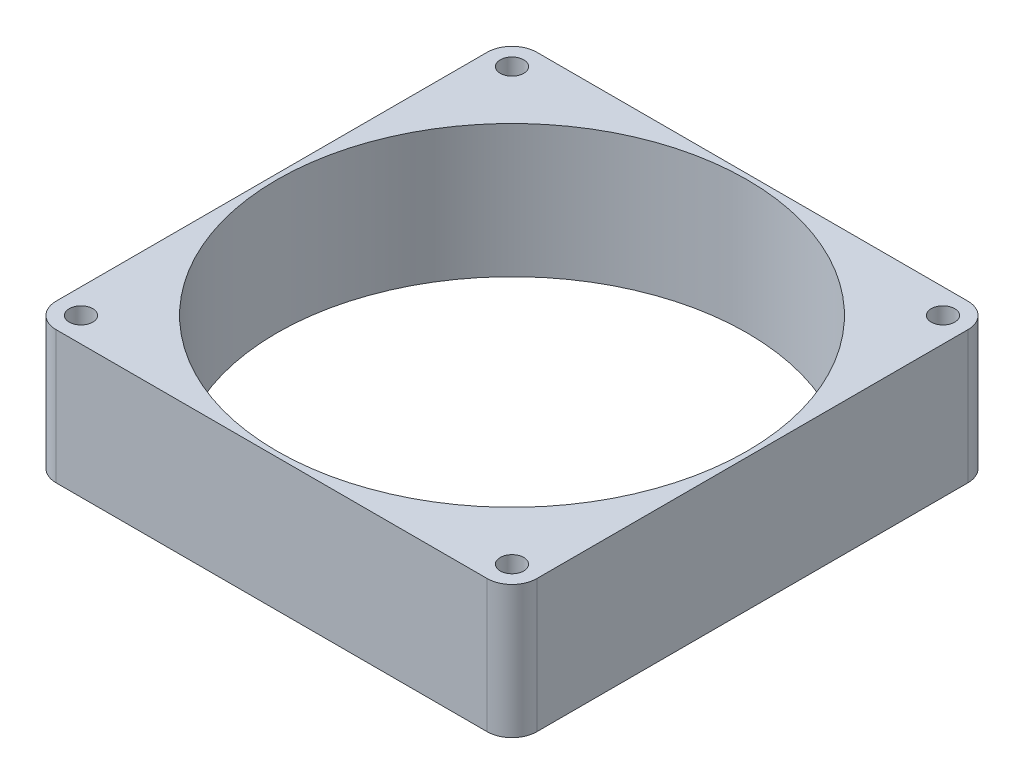
from build123d import *

# Parameters (mm, degrees)
SKETCH1_R           = 45
SKETCH1_R_2         = 2.25
BOSS_EXTRUDE1_DEPTH = 25.4


with BuildPart() as part:
    # Sketch1 → Boss-Extrude1 (new body)
    with BuildSketch(Plane(origin=(0, 0, 0), x_dir=(1, 0, 0), z_dir=(0, 1, 0))):
        with BuildLine():
            Line((-41.25, -46), (41.25, -46))
            ThreePointArc((41.25, -46), (44.608757211, -44.608757211), (46, -41.25))
            Line((46, -41.25), (46, 41.25))
            ThreePointArc((46, 41.25), (44.608757211, 44.608757211), (41.25, 46))
            Line((41.25, 46), (-41.25, 46))
            ThreePointArc((-41.25, 46), (-44.608757211, 44.608757211), (-46, 41.25))
            Line((-46, 41.25), (-46, -41.25))
            ThreePointArc((-46, -41.25), (-44.608757211, -44.608757211), (-41.25, -46))
        make_face()
        with Locations(Location((0, 0, 0), (0, 0, 270))):
            Circle(SKETCH1_R, mode=Mode.SUBTRACT)
        with Locations(Location((-41.25, 41.25, 0), (0, 0, 270))):
            Circle(SKETCH1_R_2, mode=Mode.SUBTRACT)
        with Locations(Location((41.25, 41.25, 0), (0, 0, 90))):
            Circle(SKETCH1_R_2, mode=Mode.SUBTRACT)
        with Locations(Location((41.25, -41.25, 0), (0, 0, 270))):
            Circle(SKETCH1_R_2, mode=Mode.SUBTRACT)
        with Locations(Location((-41.25, -41.25, 0), (0, 0, 90))):
            Circle(SKETCH1_R_2, mode=Mode.SUBTRACT)
    extrude(amount=BOSS_EXTRUDE1_DEPTH)


solid = part.part
